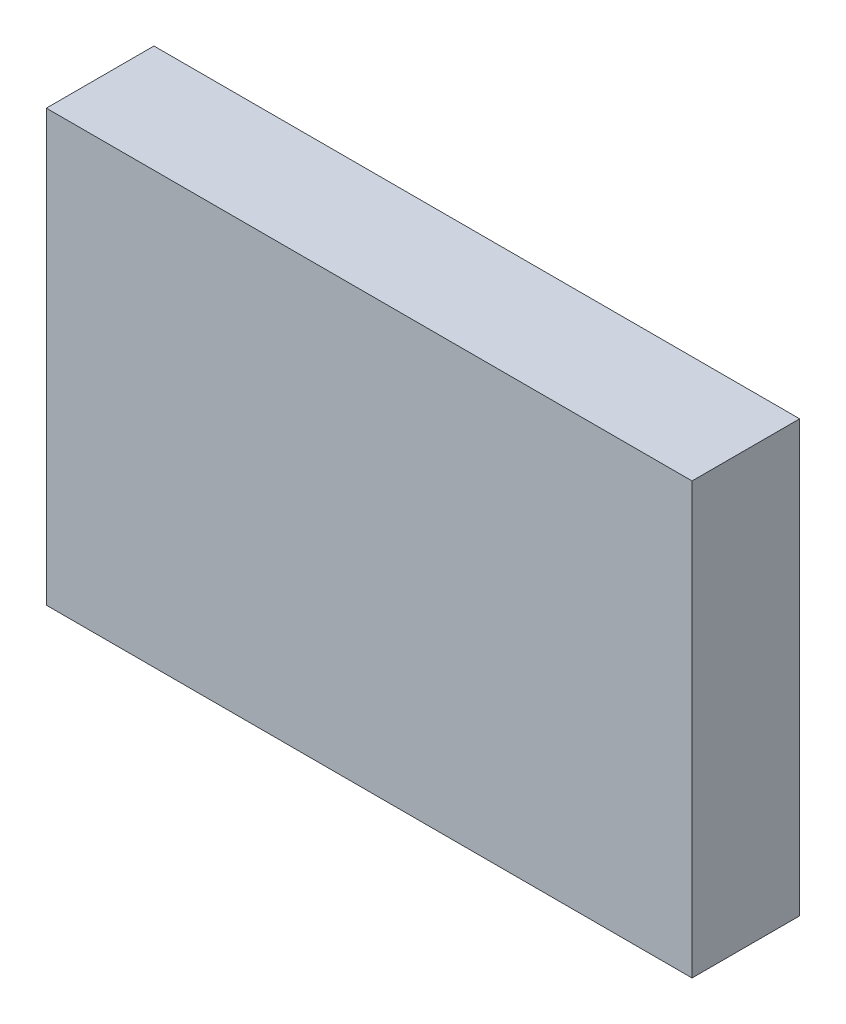
from build123d import *

# Parameters (mm, degrees)
SKETCH_1_W      = 90
SKETCH_1_H      = 60
EXTRUDE_1_DEPTH = 15


with BuildPart() as part:
    # 草图1 → 凸台-拉伸1 (new body)
    with BuildSketch(Plane.XY):
        with Locations((0, 32.766142745)):
            Rectangle(SKETCH_1_W, SKETCH_1_H)
    extrude(amount=EXTRUDE_1_DEPTH)


solid = part.part
